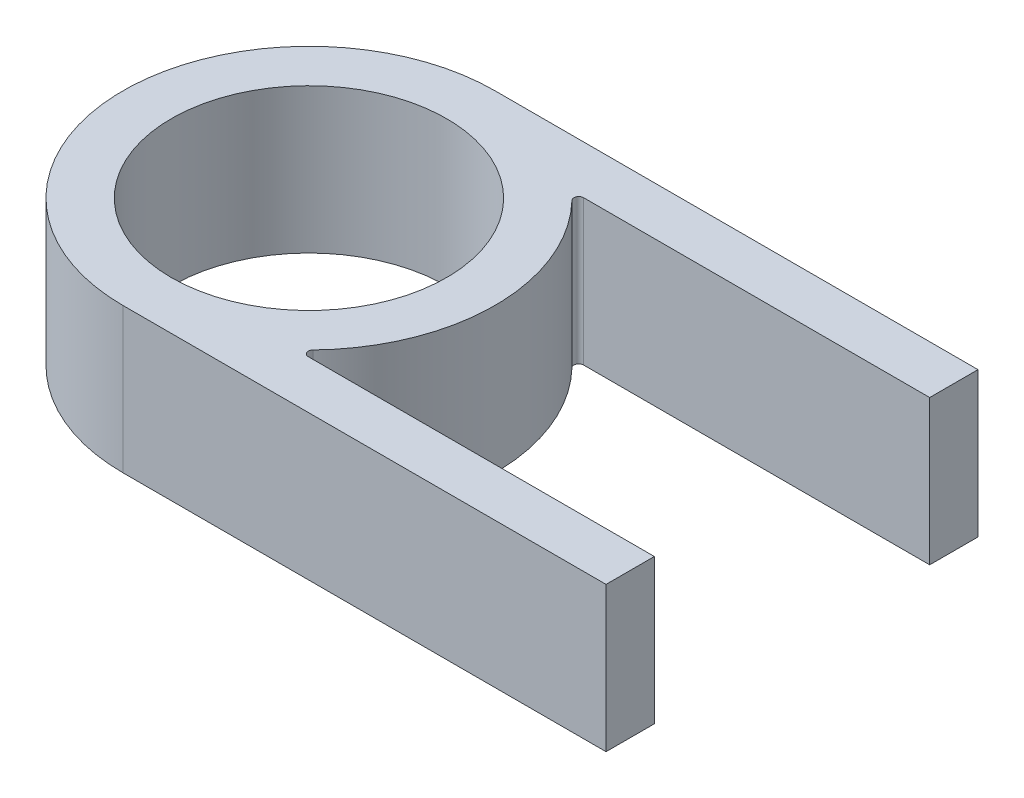
from build123d import *

# Parameters (mm, degrees)
SKETCH_1_R      = 28.5
EXTRUDE_1_DEPTH = 30


with BuildPart() as part:
    # 草图1 → 凸台-拉伸1 (new body)
    with BuildSketch(Plane(origin=(0, 0, 0), x_dir=(1, 0, 0), z_dir=(0, 1, 0))):
        with BuildLine():
            Line((28.354893758, -28.5), (100, -28.5))
            Line((100, -28.5), (100, -38.5))
            Line((100, -38.5), (0, -38.5))
            ThreePointArc((0, -38.5), (-38.5, 0), (0, 38.5))
            Line((0, 38.5), (100, 38.5))
            Line((100, 38.5), (100, 28.5))
            Line((100, 28.5), (28.354893758, 28.5))
            ThreePointArc((28.354893758, 28.5), (27.433969621, 27.889741881), (27.637048346, 26.803797468))
            ThreePointArc((27.637048346, 26.803797468), (38.5, 0), (27.637048346, -26.803797468))
            ThreePointArc((27.637048346, -26.803797468), (27.433969621, -27.889741881), (28.354893758, -28.5))
        make_face()
        with Locations(Location((0, 0, 0), (0, 0, 270))):
            Circle(SKETCH_1_R, mode=Mode.SUBTRACT)
    extrude(amount=EXTRUDE_1_DEPTH)


solid = part.part
